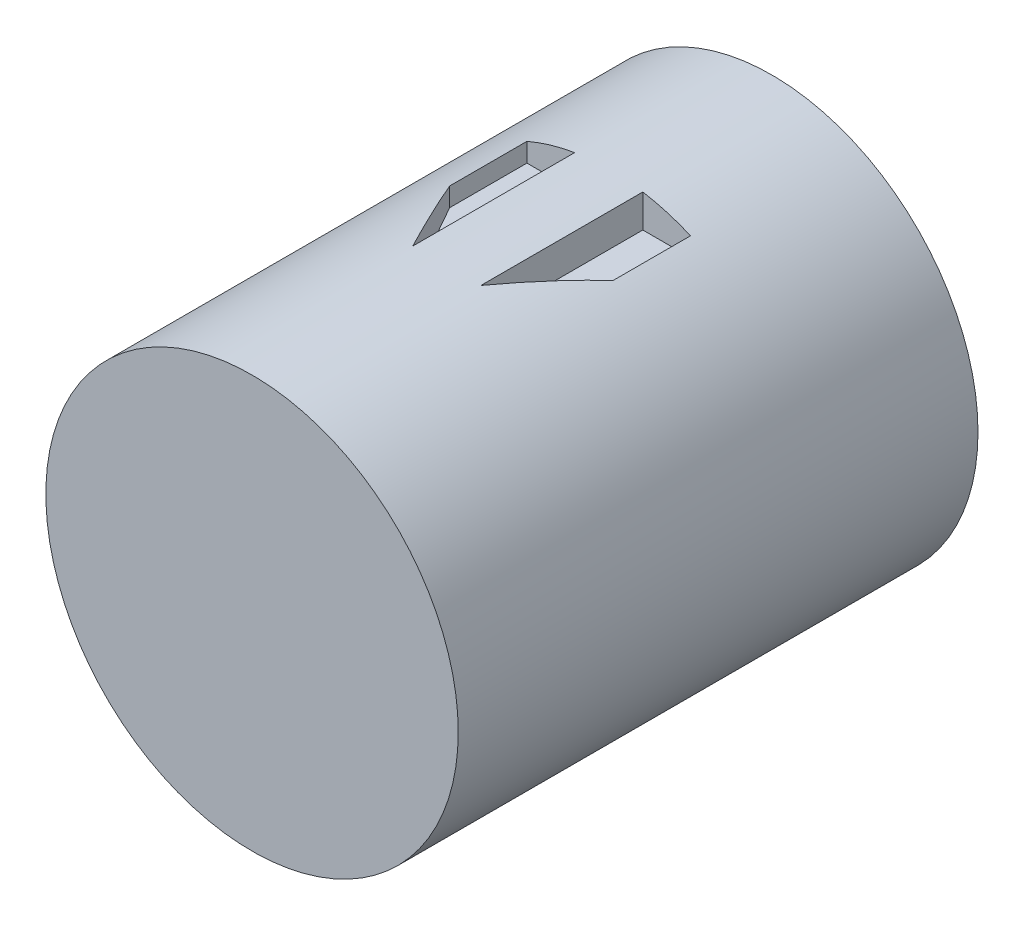
from build123d import *

# Parameters (mm, degrees)
SKETCH1_R           = 12.1
BOSS_EXTRUDE1_DEPTH = 30.5
CUT_EXTRUDE1_DEPTH  = 40.56096561


with BuildPart() as part:
    # Sketch1 → Boss-Extrude1 (new body)
    with BuildSketch(Plane.XY):
        with Locations(Location((0, 0, 0), (0, 0, 180))):
            Circle(SKETCH1_R)
    extrude(amount=BOSS_EXTRUDE1_DEPTH)

    # Sketch2 → Cut-Extrude1 (cut, through all)
    with BuildSketch(Plane(origin=(0, 10, 0), x_dir=(1, 0, 0), z_dir=(0, 1, 0))):
        Polygon((-2, -9.569188556), (-4.8, -9.569188556), (-4.8, -14.104311921), (-2, -19.069188556), align=None)
        Polygon((4.8, -14.104311921), (2, -19.069188556), (2, -9.569188556), (4.8, -9.569188556), align=None)
    extrude(amount=CUT_EXTRUDE1_DEPTH, mode=Mode.SUBTRACT)


solid = part.part
